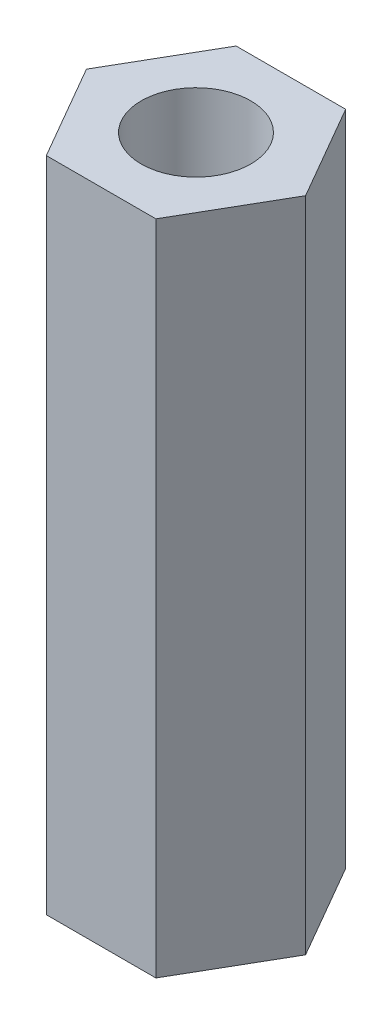
from build123d import *

# Parameters (mm, degrees)
SKETCH_1_R      = 2.5
EXTRUDE_1_DEPTH = 30


with BuildPart() as part:
    # 草图1 → 凸台-拉伸1 (new body)
    with BuildSketch(Plane(origin=(0, 0, 0), x_dir=(1, 0, 0), z_dir=(0, 1, 0))):
        Polygon((5, 0), (2.5, 4.330127019), (-2.5, 4.330127019), (-5, 0), (-2.5, -4.330127019), (2.5, -4.330127019), align=None)
        with Locations(Location((0, 0, 0), (0, 0, 270))):
            Circle(SKETCH_1_R, mode=Mode.SUBTRACT)
    extrude(amount=EXTRUDE_1_DEPTH)


solid = part.part
